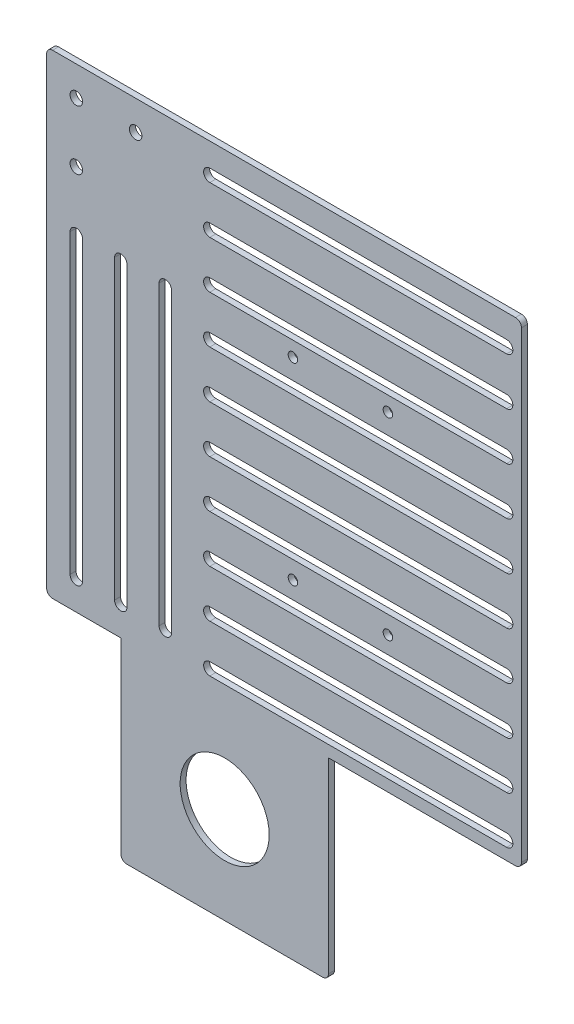
from build123d import *

# Parameters (mm, degrees)
SKETCH_1_W          = 160
SKETCH_1_H          = 160
EXTRUDE_1_DEPTH     = 2
SKETCH_2_W          = 70
SKETCH_2_H          = 65
EXTRUDE_2_DEPTH     = 2
SKETCH_3_R          = 2.1
CUT_EXTRUDE_1_DEPTH = 166.61702811
SKETCH_4_R          = 15
CUT_EXTRUDE_2_DEPTH = 10
FILLET_1_R          = 2
SKETCH_5_R          = 1.6
CUT_EXTRUDE_3_DEPTH = 10


with BuildPart() as part:
    # 草图1 → 凸台-拉伸1 (new body)
    with BuildSketch(Plane.XY):
        Rectangle(SKETCH_1_W, SKETCH_1_H)
    extrude(amount=EXTRUDE_1_DEPTH)

    # 草图2 → 凸台-拉伸2 (add, through all)
    with BuildSketch(Plane.XY.offset(2)):
        with Locations((-20, -112.5)):
            Rectangle(SKETCH_2_W, SKETCH_2_H)
    extrude(amount=-EXTRUDE_2_DEPTH)

    # 草图3 → 切除-拉伸1 (cut, through all)
    with BuildSketch(Plane.XY.offset(2)):
        with Locations((-70, 70)):
            Circle(SKETCH_3_R)
        with Locations((-50, 70)):
            Circle(SKETCH_3_R)
        with Locations((-70, 50)):
            Circle(SKETCH_3_R)
    extrude(amount=-CUT_EXTRUDE_1_DEPTH, mode=Mode.SUBTRACT)

    # 草图4 → 切除-拉伸2 (cut)
    with BuildSketch(Plane.XY.offset(2)):
        with Locations((-20, -112.5)):
            Circle(SKETCH_4_R)
        with BuildLine():
            Line((-25, 72.1), (75, 72.1))
            ThreePointArc((75, 72.1), (77.1, 70), (75, 67.9))
            Line((75, 67.9), (-25, 67.9))
            ThreePointArc((-25, 67.9), (-27.1, 70), (-25, 72.1))
        make_face()
        with BuildLine():
            Line((-67.9, 30), (-67.9, -70))
            ThreePointArc((-67.9, -70), (-70, -72.1), (-72.1, -70))
            Line((-72.1, -70), (-72.1, 30))
            ThreePointArc((-72.1, 30), (-70, 32.1), (-67.9, 30))
        make_face()
        with BuildLine():
            Line((-25, 56.1), (75, 56.1))
            ThreePointArc((75, 56.1), (77.1, 54), (75, 51.9))
            Line((75, 51.9), (-25, 51.9))
            ThreePointArc((-25, 51.9), (-27.1, 54), (-25, 56.1))
        make_face()
        with BuildLine():
            Line((-25, 40.1), (75, 40.1))
            ThreePointArc((75, 40.1), (77.1, 38), (75, 35.9))
            Line((75, 35.9), (-25, 35.9))
            ThreePointArc((-25, 35.9), (-27.1, 38), (-25, 40.1))
        make_face()
        with BuildLine():
            Line((-25, 24.1), (75, 24.1))
            ThreePointArc((75, 24.1), (77.1, 22), (75, 19.9))
            Line((75, 19.9), (-25, 19.9))
            ThreePointArc((-25, 19.9), (-27.1, 22), (-25, 24.1))
        make_face()
        with BuildLine():
            Line((-25, 8.1), (75, 8.1))
            ThreePointArc((75, 8.1), (77.1, 6), (75, 3.9))
            Line((75, 3.9), (-25, 3.9))
            ThreePointArc((-25, 3.9), (-27.1, 6), (-25, 8.1))
        make_face()
        with BuildLine():
            Line((-25, -7.9), (75, -7.9))
            ThreePointArc((75, -7.9), (77.1, -10), (75, -12.1))
            Line((75, -12.1), (-25, -12.1))
            ThreePointArc((-25, -12.1), (-27.1, -10), (-25, -7.9))
        make_face()
        with BuildLine():
            Line((-25, -23.9), (75, -23.9))
            ThreePointArc((75, -23.9), (77.1, -26), (75, -28.1))
            Line((75, -28.1), (-25, -28.1))
            ThreePointArc((-25, -28.1), (-27.1, -26), (-25, -23.9))
        make_face()
        with BuildLine():
            Line((-25, -39.9), (75, -39.9))
            ThreePointArc((75, -39.9), (77.1, -42), (75, -44.1))
            Line((75, -44.1), (-25, -44.1))
            ThreePointArc((-25, -44.1), (-27.1, -42), (-25, -39.9))
        make_face()
        with BuildLine():
            Line((-25, -55.9), (75, -55.9))
            ThreePointArc((75, -55.9), (77.1, -58), (75, -60.1))
            Line((75, -60.1), (-25, -60.1))
            ThreePointArc((-25, -60.1), (-27.1, -58), (-25, -55.9))
        make_face()
        with BuildLine():
            Line((-25, -71.9), (75, -71.9))
            ThreePointArc((75, -71.9), (77.1, -74), (75, -76.1))
            Line((75, -76.1), (-25, -76.1))
            ThreePointArc((-25, -76.1), (-27.1, -74), (-25, -71.9))
        make_face()
        with BuildLine():
            Line((-57.1, 30), (-57.1, -70))
            ThreePointArc((-57.1, -70), (-55, -72.1), (-52.9, -70))
            Line((-52.9, -70), (-52.9, 30))
            ThreePointArc((-52.9, 30), (-55, 32.1), (-57.1, 30))
        make_face()
        with BuildLine():
            Line((-42.1, 30), (-42.1, -70))
            ThreePointArc((-42.1, -70), (-40, -72.1), (-37.9, -70))
            Line((-37.9, -70), (-37.9, 30))
            ThreePointArc((-37.9, 30), (-40, 32.1), (-42.1, 30))
        make_face()
    extrude(amount=-CUT_EXTRUDE_2_DEPTH, mode=Mode.SUBTRACT)

    # 圆角1
    fillet_1_edges = [part.edges().sort_by_distance(p)[0] for p in [
        (15, -145, 1),
        (-55, -145, 1),
        (80, -80, 1),
        (-80, -80, 1),
        (-80, 80, 1),
        (80, 80, 1),
    ]]
    fillet(fillet_1_edges, radius=FILLET_1_R)

    # 草图5 → 切除-拉伸3 (cut)
    with BuildSketch(Plane.XY.offset(2)):
        with Locations((35, 30.9)):
            Circle(SKETCH_5_R)
        with Locations((3, 30.9)):
            Circle(SKETCH_5_R)
        with Locations((3, -34.1)):
            Circle(SKETCH_5_R)
        with Locations((35, -34.1)):
            Circle(SKETCH_5_R)
    extrude(amount=-CUT_EXTRUDE_3_DEPTH, mode=Mode.SUBTRACT)


solid = part.part
